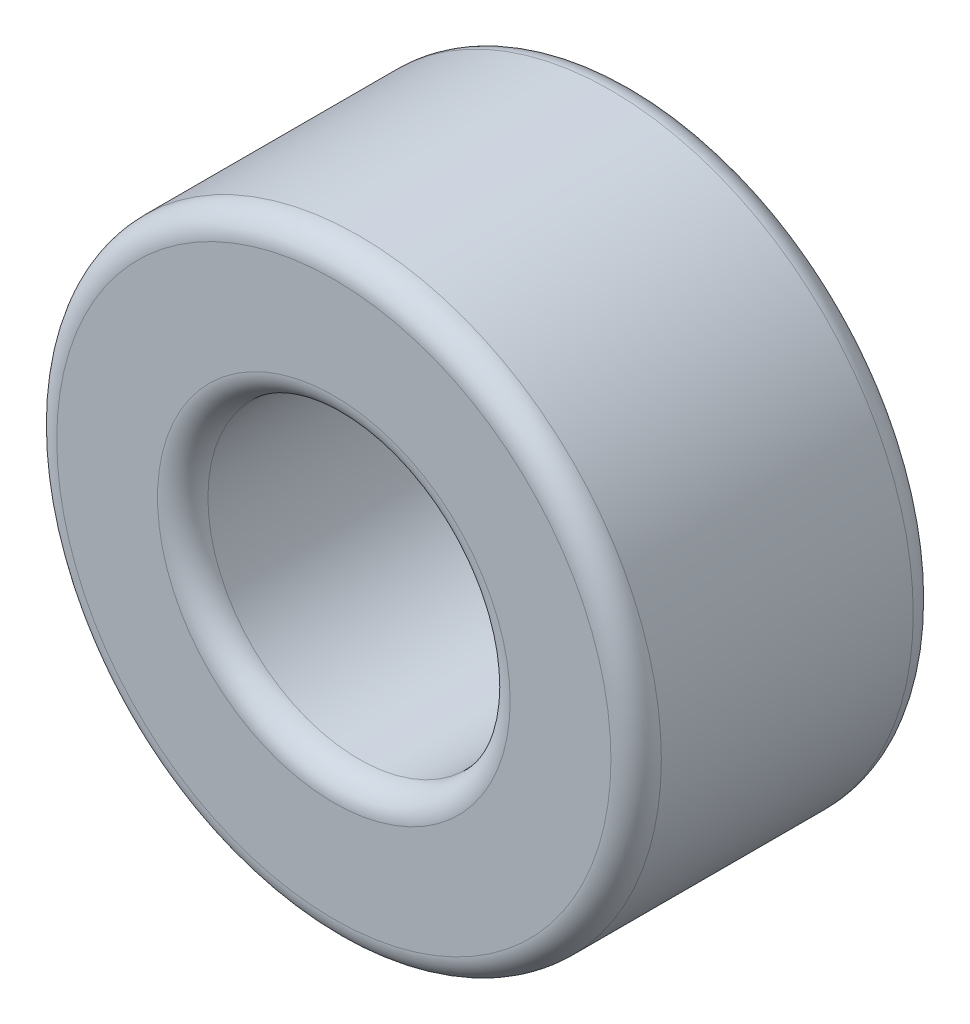
from build123d import *

# Parameters (mm, degrees)
SKETCH_1_R      = 6
SKETCH_1_R_2    = 3
EXTRUDE_1_DEPTH = 6
FILLET_1_R      = 0.5


with BuildPart() as part:
    # 草图1 → 凸台-拉伸1 (new body)
    with BuildSketch(Plane.XY):
        Circle(SKETCH_1_R)
        Circle(SKETCH_1_R_2, mode=Mode.SUBTRACT)
    extrude(amount=EXTRUDE_1_DEPTH)

    # 圆角1
    fillet_1_edges = [part.edges().sort_by_distance(p)[0] for p in [
        (-6, 0, 0),
        (-6, 0, 6),
        (-3, 0, 0),
        (-3, 0, 6),
    ]]
    fillet(fillet_1_edges, radius=FILLET_1_R)


solid = part.part
